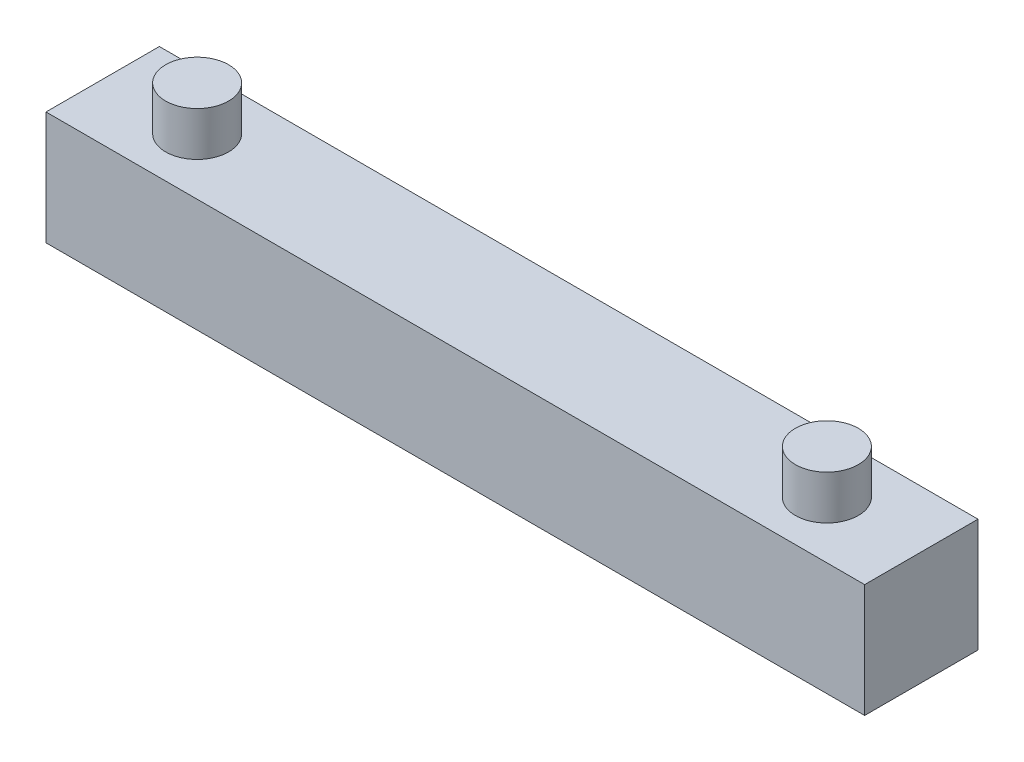
from build123d import *

# Parameters (mm, degrees)
SKETCH_1_W      = 65
SKETCH_1_H      = 9
EXTRUDE_1_DEPTH = 9
SKETCH_2_R      = 2.5
EXTRUDE_2_DEPTH = 3.5


with BuildPart() as part:
    # 草圖1 → 擠出1 (new body)
    with BuildSketch(Plane(origin=(0, 0, 0), x_dir=(-1, 0, 0), z_dir=(0, 1, 0))):
        Rectangle(SKETCH_1_W, SKETCH_1_H)
    extrude(amount=EXTRUDE_1_DEPTH)

    # 草圖2 → 擠出2 (add)
    with BuildSketch(Plane(origin=(0, 9, 0), x_dir=(-1, 0, 0), z_dir=(0, 1, 0))):
        with Locations(Location((-25, 0, 0), (0, 0, 270))):
            Circle(SKETCH_2_R)
        with Locations(Location((25, 0, 0), (0, 0, 270))):
            Circle(SKETCH_2_R)
    extrude(amount=EXTRUDE_2_DEPTH)


solid = part.part
